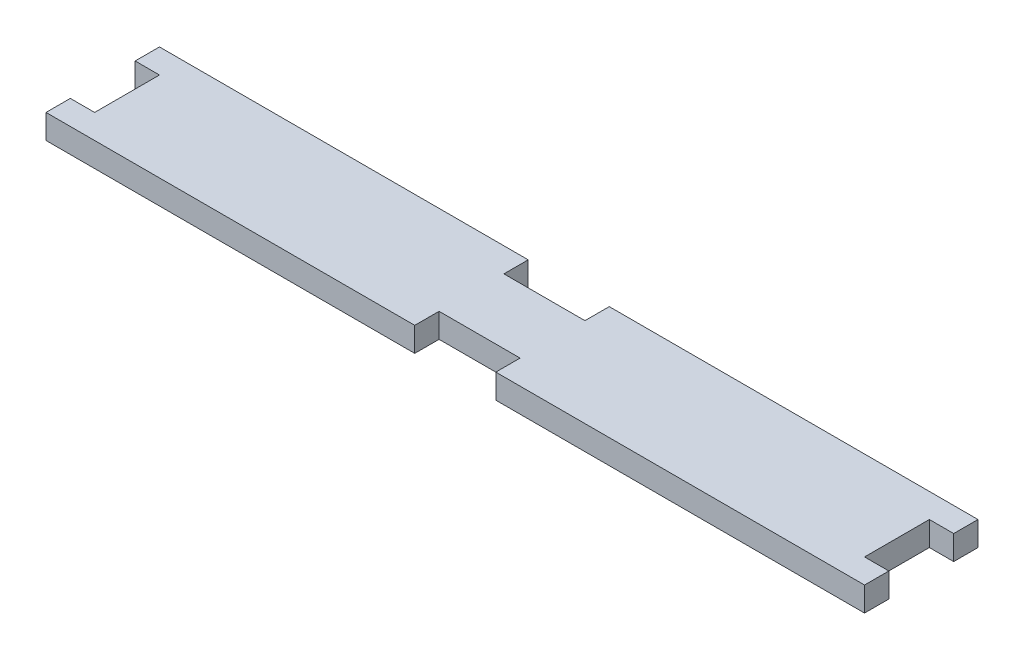
from build123d import *

# Parameters (mm, degrees)
ESQUISSE2_W             = 91
ESQUISSE2_H             = 6
BOSS_EXTRU_1_DEPTH      = 6
BOSS_EXTRU_1_2_DEPTH    = 6
BOSS_EXTRU_2_DEPTH      = 22
ESQUISSE4_W             = 20
ESQUISSE4_H             = 6
ENL_V_MAT_EXTRU_1_DEPTH = 6
ESQUISSE5_W             = 6
ESQUISSE5_H             = 16
ENL_V_MAT_EXTRU_2_DEPTH = 6


with BuildPart() as part:
    # Esquisse2 → Boss.-Extru.1 (new body)
    with BuildSketch(Plane(origin=(0, 22.295844579, 0), x_dir=(1, 0, 0), z_dir=(0, 1, 0))):
        with Locations((-57.503078089, -203.00005)):
            Rectangle(ESQUISSE2_W, ESQUISSE2_H)
    extrude(amount=BOSS_EXTRU_1_DEPTH)



with BuildPart() as body_2:
    # Esquisse2 → Boss.-Extru.1 2 (new body)
    with BuildSketch(Plane(origin=(0, 22.295844579, 0), x_dir=(1, 0, 0), z_dir=(0, 1, 0))):
        with Locations((53.496921911, -203.00005)):
            Rectangle(ESQUISSE2_W, ESQUISSE2_H)
    extrude(amount=BOSS_EXTRU_1_2_DEPTH)


with BuildPart() as part_1:
    add(part.part)

    add(body_2.part)  # Boss.-Extru.2 merges body 2
    # Esquisse3 → Boss.-Extru.2 (add)
    with BuildSketch(Plane(origin=(0, 0, 200.00005), x_dir=(-1, 0, 0), z_dir=(0, 0, -1))):
        Polygon((-7.996921911, 28.295844579), (12.003078089, 28.295844579), (103.003078089, 28.295844579), (103.003078089, 22.295844579), (12.003078089, 22.295844579), (-7.996921911, 22.295844579), (-98.996921911, 22.295844579), (-98.996921911, 28.295844579), align=None)
    extrude(amount=BOSS_EXTRU_2_DEPTH)

    # Esquisse4 → Enlèv. mat.-Extru.1 (cut)
    with BuildSketch(Plane(origin=(0, 28.295844579, 0), x_dir=(1, 0, 0), z_dir=(0, 1, 0))):
        with Locations((-2.003078089, -203.00005)):
            Rectangle(ESQUISSE4_W, ESQUISSE4_H)
        with Locations((-2.003078089, -181.00005)):
            Rectangle(ESQUISSE4_W, ESQUISSE4_H)
    extrude(amount=-ENL_V_MAT_EXTRU_1_DEPTH, mode=Mode.SUBTRACT)

    # Esquisse5 → Enlèv. mat.-Extru.2 (cut)
    with BuildSketch(Plane(origin=(0, 28.295844579, 0), x_dir=(1, 0, 0), z_dir=(0, 1, 0))):
        with Locations((95.996921911, -192.00005)):
            Rectangle(ESQUISSE5_W, ESQUISSE5_H)
        with Locations((-100.003078089, -192.00005)):
            Rectangle(ESQUISSE5_W, ESQUISSE5_H)
    extrude(amount=-ENL_V_MAT_EXTRU_2_DEPTH, mode=Mode.SUBTRACT)


solid = part_1.part
